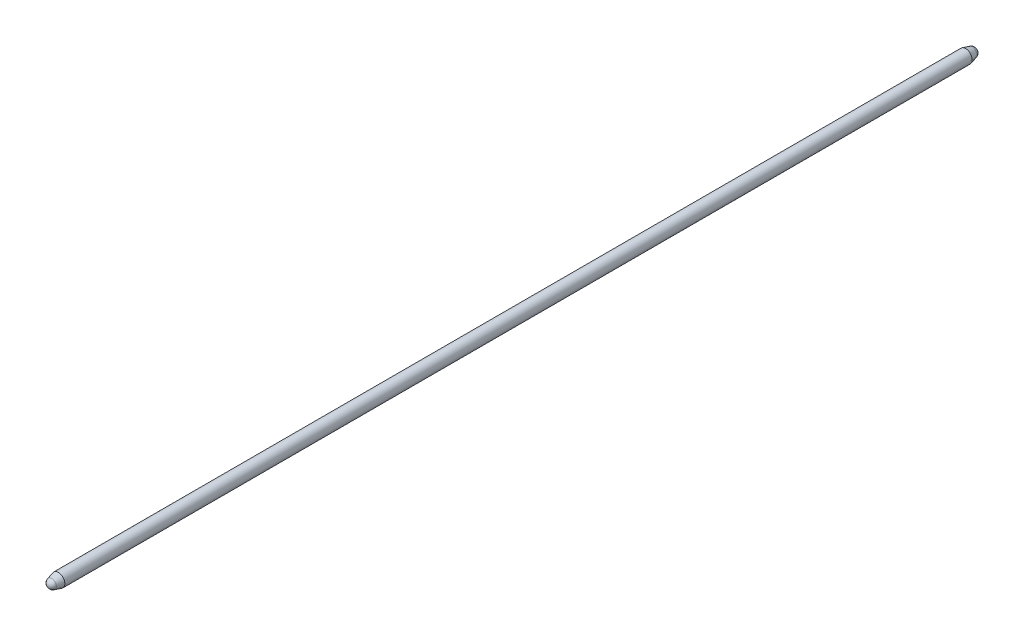
from build123d import *


with BuildPart() as part:
    # Sketch2 → Revolve1 (revolve)
    with BuildSketch(Plane(origin=(0, 0, 0), x_dir=(0, 0, -1), z_dir=(1, 0, 0))):
        with BuildLine():
            Line((1767.122776535, 25.4), (1793.243821893, 18.400886991))
            ThreePointArc((1793.243821893, 18.400886991), (1803.426700216, 11.596905223), (1807.363319084, 0))
            Line((1807.363319084, 0), (1767.122776535, 0))
            Line((1767.122776535, 0), (1767.122776535, 22.987))
            Line((1767.122776535, 22.987), (-1767.122776535, 22.987))
            Line((-1767.122776535, 22.987), (-1767.122776535, 0))
            Line((-1767.122776535, 0), (-1807.363319084, 0))
            ThreePointArc((-1807.363319084, 0), (-1803.426700216, 11.596905223), (-1793.243821893, 18.400886991))
            Line((-1793.243821893, 18.400886991), (-1767.122776535, 25.4))
            Line((-1767.122776535, 25.4), (1767.122776535, 25.4))
        make_face()
    revolve(axis=Axis((0, 0, -1807.363319084), (0, 0, 1)))


solid = part.part
